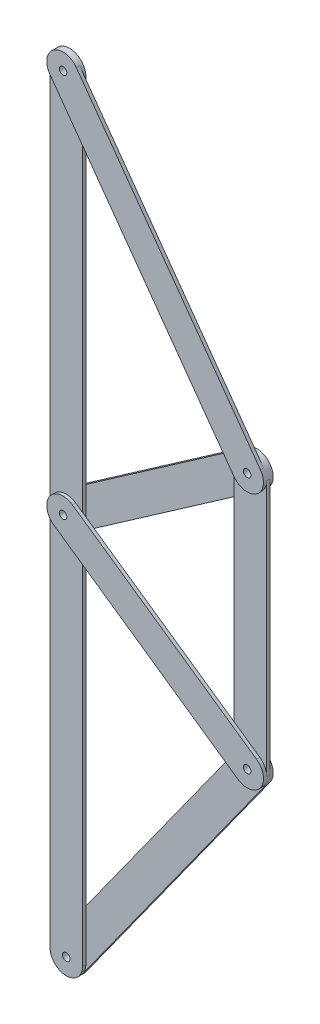
from build123d import *
from build123d.topology import SkipClean

# Parameters (mm, degrees)
CD_DEPTH                = 4.50787
BE_AE_DEPTH             = 4.50787
BOSS_EXTRUDE3_START     = -4.50787
BOSS_EXTRUDE3_DEPTH     = 4.50787
BOSS_EXTRUDE4_DEPTH     = 4.50787
BOSS_EXTRUDE5_START     = -4.50787
BOSS_EXTRUDE5_DEPTH     = 4.50787
BOSS_EXTRUDE7_DEPTH     = 4.50787
CUT_EXTRUDE1_DEPTH      = 784.294801
CUT_EXTRUDE1_DEPTH_BACK = 784.294801
SKETCH5_R               = 5.211191


with BuildPart() as part:
    # Sketch1 → CD (new body)
    with BuildSketch(Plane(origin=(0, 0, 0), x_dir=(0, 1, 0), z_dir=(0, 0, 1))):
        with BuildLine():
            Line((0, 22.539325), (354.92135, 22.539325))
            ThreePointArc((354.92135, 22.539325), (377.460675, 0), (354.92135, -22.539325))
            Line((354.92135, -22.539325), (0, -22.539325))
            ThreePointArc((0, -22.539325), (-22.539325, 0), (0, 22.539325))
        make_face()
    extrude(amount=CD_DEPTH)



with BuildPart() as body_2:
    # Sketch1<4> → BE & AE (new body)
    with BuildSketch(Plane(origin=(0, 0, 0), x_dir=(0, 1, 0), z_dir=(0, 0, 1))):
        with BuildLine():
            Line((177.460675, 277.460675), (-354.92135, 277.460675))
            ThreePointArc((-354.92135, 277.460675), (-377.460675, 254.92135), (-354.92135, 232.382025))
            Line((-354.92135, 232.382025), (177.460675, 232.382025))
            ThreePointArc((177.460675, 232.382025), (154.92135, 254.92135), (177.460675, 277.460675))
        make_face()
        with BuildLine():
            Line((709.8427, 277.460675), (177.460675, 277.460675))
            ThreePointArc((177.460675, 277.460675), (200, 254.92135), (177.460675, 232.382025))
            Line((177.460675, 232.382025), (709.8427, 232.382025))
            ThreePointArc((709.8427, 232.382025), (732.382025, 254.92135), (709.8427, 277.460675))
        make_face()
        with BuildLine():
            ThreePointArc((177.460675, 232.382025), (200, 254.92135), (177.460675, 277.460675))
            ThreePointArc((177.460675, 277.460675), (154.92135, 254.92135), (177.460675, 232.382025))
        make_face()
    extrude(amount=BE_AE_DEPTH)


with BuildPart() as part_1:
    add(part.part)

    add(body_2.part)  # Boss-Extrude3 merges body 2
    # Sketch1<5> → Boss-Extrude3 (add)
    with BuildSketch(Plane(origin=(0, 0, 0), x_dir=(0, 1, 0), z_dir=(0, 0, 1)).offset(BOSS_EXTRUDE3_START)):
        with BuildLine():
            Line((-341.772655, 273.227988), (13.148695, 18.306638))
            ThreePointArc((13.148695, 18.306638), (18.306638, -13.148695), (-13.148695, -18.306638))
            Line((-13.148695, -18.306638), (-368.070045, 236.614712))
            ThreePointArc((-368.070045, 236.614712), (-373.227988, 268.070045), (-341.772655, 273.227988))
        make_face()
    extrude(amount=BOSS_EXTRUDE3_DEPTH)

    # Sketch3 → Boss-Extrude4 (add)
    with BuildSketch(Plane.XY.offset(4.50787)):
        with BuildLine():
            ThreePointArc((-242.043875, 195.959102), (-273.419777, 190.33815), (-267.798825, 158.962248))
            Line((-267.798825, 158.962248), (-12.877475, -18.498427))
            ThreePointArc((-12.877475, -18.498427), (18.498427, -12.877475), (12.877475, 18.498427))
            Line((12.877475, 18.498427), (-242.043875, 195.959102))
        make_face()
    extrude(amount=BOSS_EXTRUDE4_DEPTH)

    # Sketch1<6> → Boss-Extrude5 (add)
    with BuildSketch(Plane(origin=(0, 0, 0), x_dir=(0, 1, 0), z_dir=(0, 0, 1)).offset(BOSS_EXTRUDE5_START)):
        with BuildLine():
            Line((195.959102, 267.798825), (373.419777, 12.877475))
            ThreePointArc((373.419777, 12.877475), (367.798825, -18.498427), (336.422923, -12.877475))
            Line((336.422923, -12.877475), (158.962248, 242.043875))
            ThreePointArc((158.962248, 242.043875), (164.5832, 273.419777), (195.959102, 267.798825))
        make_face()
    extrude(amount=BOSS_EXTRUDE5_DEPTH)

    # Sketch4 → Boss-Extrude7 (add)
    with SkipClean():  # the faces are left unmerged after this step: merging them gives an invalid solid
        with BuildSketch(Plane.XY.offset(4.50787)):
            with BuildLine():
                Line((-236.614712, 722.991395), (18.306638, 368.070045))
                ThreePointArc((18.306638, 368.070045), (13.148695, 336.614712), (-18.306638, 341.772655))
                Line((-18.306638, 341.772655), (-273.227988, 696.694005))
                ThreePointArc((-273.227988, 696.694005), (-268.070045, 728.149338), (-236.614712, 722.991395))
            make_face()
        extrude(amount=BOSS_EXTRUDE7_DEPTH)

    # Sketch5 → Cut-Extrude1 (cut, two sides: drawn at the far end of the back side and taken through both)
    with SkipClean():  # the faces are left unmerged after this step: merging them gives an invalid solid
        with BuildSketch(Plane.XY.offset(9.01574).offset(-CUT_EXTRUDE1_DEPTH_BACK)):
            Circle(SKETCH5_R)
            with Locations((-254.92135, 177.460675)):
                Circle(SKETCH5_R)
            with Locations((-254.92135, -354.92135)):
                Circle(SKETCH5_R)
            with Locations((0, 354.92135)):
                Circle(SKETCH5_R)
            with Locations((-254.92135, 709.8427)):
                Circle(SKETCH5_R)
        extrude(amount=CUT_EXTRUDE1_DEPTH + CUT_EXTRUDE1_DEPTH_BACK, mode=Mode.SUBTRACT)


solid = part_1.part
